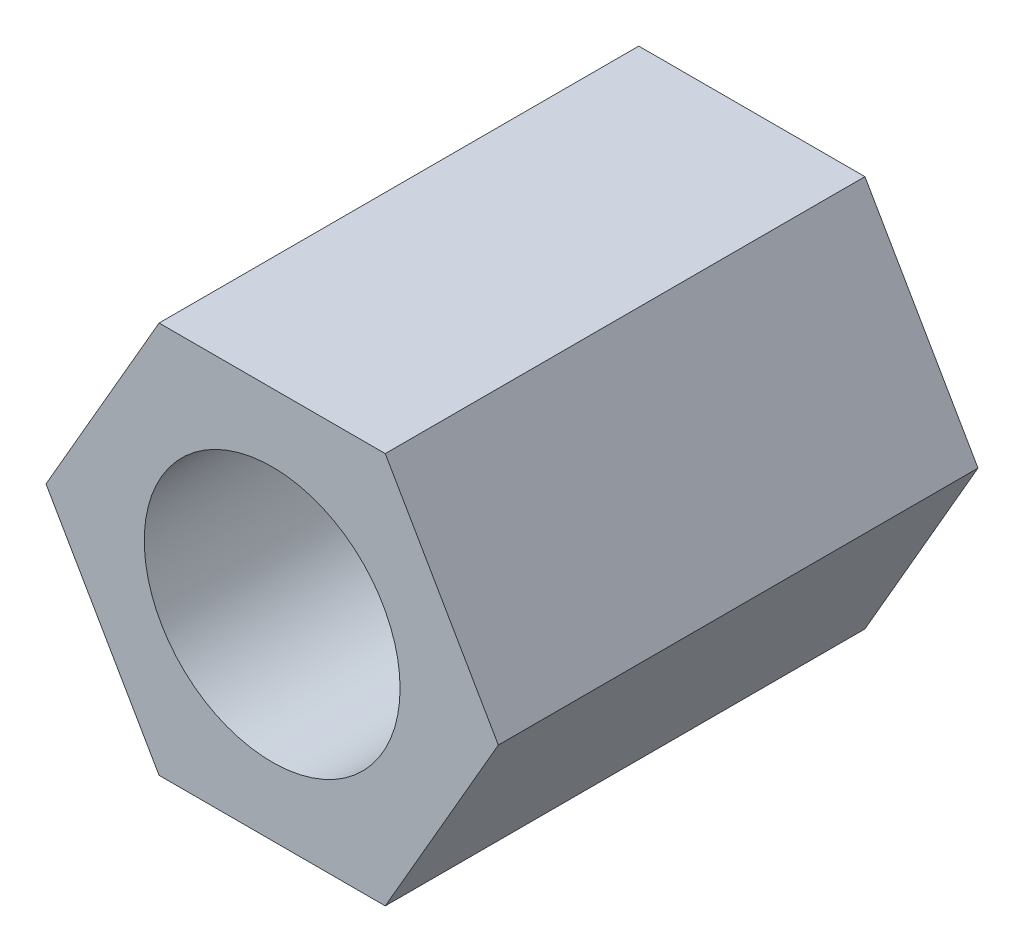
from build123d import *

# Parameters (mm, degrees)
SKETCH_1_R      = 1.6
EXTRUDE_1_DEPTH = 6


with BuildPart() as part:
    # 草图1 → 凸台-拉伸1 (new body)
    with BuildSketch(Plane.XY):
        Polygon((2.829016319, 0), (1.41450816, 2.45), (-1.41450816, 2.45), (-2.829016319, 0), (-1.41450816, -2.45), (1.41450816, -2.45), align=None)
        Circle(SKETCH_1_R, mode=Mode.SUBTRACT)
    extrude(amount=EXTRUDE_1_DEPTH)


solid = part.part
